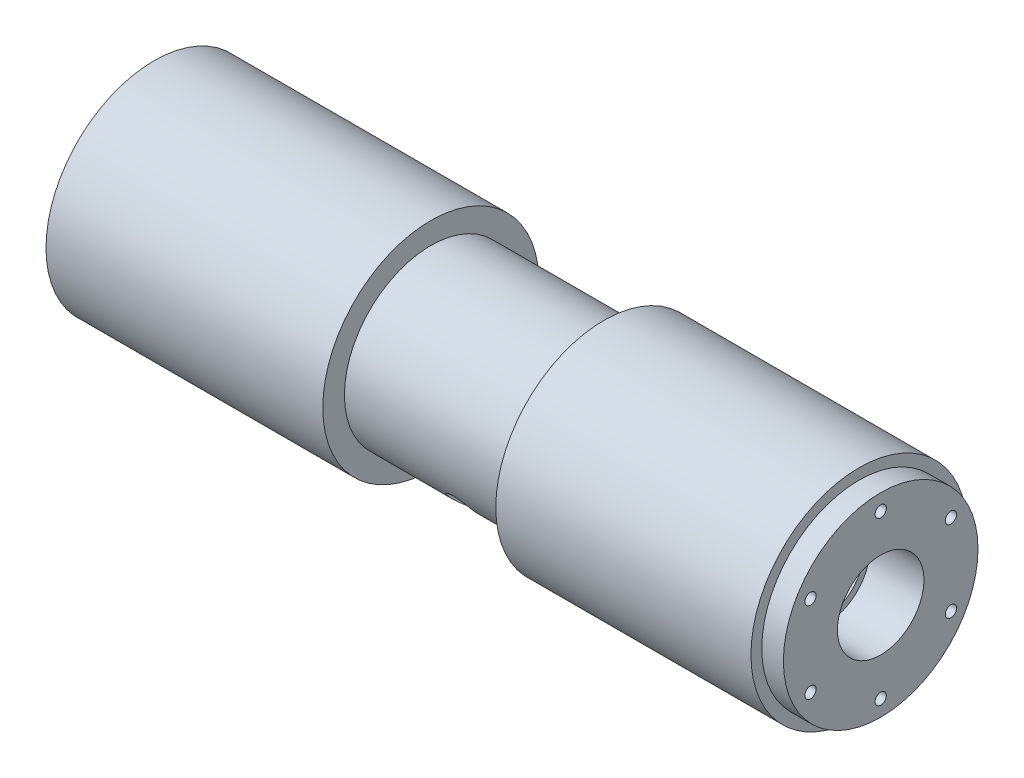
from build123d import *

# Parameters (mm, degrees)
SKETCH1_R                 = 31.75
SKETCH1_R_2               = 10.795
BOSS_EXTRUDE1_DEPTH       = 106.68
SKETCH2_R                 = 12.7
CUT_EXTRUDE1_DEPTH        = 15.875
CUT_EXTRUDE2_START        = -81.28
SKETCH3_OUTSIDE_W         = 111.798
SKETCH3_OUTSIDE_H         = 111.798
SKETCH3_OUTSIDE_R         = 25.4
CUT_EXTRUDE2_DEPTH        = 50.8
CUT_EXTRUDE3_DEPTH        = 25.4
CUT_EXTRUDE3_DEPTH_BACK   = 25.4
SKETCH5_R                 = 3.96875
M4X0_7_TAPPED_HOLE1_D     = 3.3
M4X0_7_TAPPED_HOLE1_DEPTH = 9.906
M4X0_7_TAPPED_HOLE1_TIP   = 0.991420021
SKETCH11_OUTSIDE_W        = 111.798
SKETCH11_OUTSIDE_H        = 111.798
SKETCH11_OUTSIDE_R        = 28.575
CUT_EXTRUDE4_DEPTH        = 6.35


with BuildPart() as part:
    # Sketch1 → Boss-Extrude1 (new body)
    with BuildSketch(Plane(origin=(0, 0, 0), x_dir=(0, 0, -1), z_dir=(1, 0, 0))):
        Circle(SKETCH1_R)
        Circle(SKETCH1_R_2, mode=Mode.SUBTRACT)
    boss_extrude1 = extrude(amount=BOSS_EXTRUDE1_DEPTH)

    # Sketch2 → Cut-Extrude1 (cut)
    with BuildSketch(Plane.ZY):
        Circle(SKETCH2_R)
    cut_extrude1 = extrude(amount=-CUT_EXTRUDE1_DEPTH, mode=Mode.SUBTRACT)

    # Mirror1: Boss-Extrude1, Cut-Extrude1 across plane
    add(boss_extrude1.mirror(Plane(origin=(106.68, 0, 0), x_dir=(0, 0, 1), z_dir=(1, 0, 0))))
    add(cut_extrude1.mirror(Plane(origin=(106.68, 0, 0), x_dir=(0, 0, 1), z_dir=(1, 0, 0))), mode=Mode.SUBTRACT)

    # Sketch3 outside → Cut-Extrude2 (cut)
    with BuildSketch(Plane.ZY.offset(CUT_EXTRUDE2_START)):
        Rectangle(SKETCH3_OUTSIDE_W, SKETCH3_OUTSIDE_H)
        Circle(SKETCH3_OUTSIDE_R, mode=Mode.SUBTRACT)
    extrude(amount=-CUT_EXTRUDE2_DEPTH, mode=Mode.SUBTRACT)

    # Sketch5 → Cut-Extrude3 (cut, two sides: drawn at the far end of the back side and taken through both)
    with BuildSketch(Plane.XY.offset(-CUT_EXTRUDE3_DEPTH_BACK)):
        with Locations((109.22, -17.4625)):
            Circle(SKETCH5_R)
    extrude(amount=CUT_EXTRUDE3_DEPTH + CUT_EXTRUDE3_DEPTH_BACK, mode=Mode.SUBTRACT)

    # M4x0.7 Tapped Hole1
    with Locations(Plane(origin=(213.36, 0, 0), x_dir=(0, 0, -1), z_dir=(1, 0, 0))):
        with Locations((20.622229928, -11.90625), (0, -23.8125), (20.622229928, 11.90625), (0, 23.8125), (-20.622229928, 11.90625), (-20.622229928, -11.90625)):
            Hole(M4X0_7_TAPPED_HOLE1_D / 2, depth=M4X0_7_TAPPED_HOLE1_DEPTH)
            with Locations((0, 0, -(M4X0_7_TAPPED_HOLE1_DEPTH + M4X0_7_TAPPED_HOLE1_TIP / 2))):  # 118° drill point
                Cone(0, M4X0_7_TAPPED_HOLE1_D / 2, M4X0_7_TAPPED_HOLE1_TIP, mode=Mode.SUBTRACT)

    # Sketch11 outside → Cut-Extrude4 (cut)
    with BuildSketch(Plane(origin=(213.36, 0, 0), x_dir=(0, 0, -1), z_dir=(1, 0, 0))):
        Rectangle(SKETCH11_OUTSIDE_W, SKETCH11_OUTSIDE_H)
        Circle(SKETCH11_OUTSIDE_R, mode=Mode.SUBTRACT)
    extrude(amount=-CUT_EXTRUDE4_DEPTH, mode=Mode.SUBTRACT)


solid = part.part
